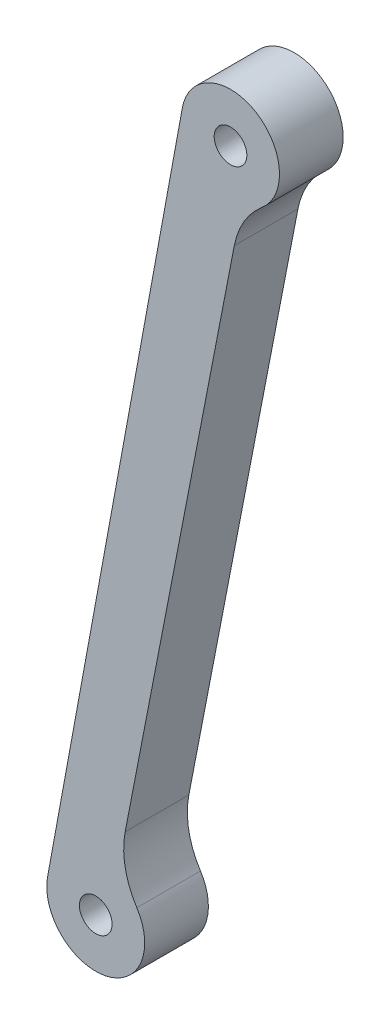
from build123d import *

# Parameters (mm, degrees)
SKETCH7_R           = 1
BOSS_EXTRUDE2_DEPTH = 3.9


with BuildPart() as part:
    # Sketch7 → Boss-Extrude2 (new body)
    with BuildSketch(Plane.XY):
        with BuildLine():
            Line((14.939494353, 43.671800322), (23.195274145, 88.592442488))
            ThreePointArc((23.195274145, 88.592442488), (27.655886689, 90.642426594), (28.073058509, 85.75106004))
            ThreePointArc((28.073058509, 85.75106004), (26.977195581, 84.457381822), (26.376654335, 82.871863263))
            Line((26.376654335, 82.871863263), (19.693168718, 48.435996906))
            ThreePointArc((19.693168718, 48.435996906), (19.693341996, 46.529807983), (20.406889033, 44.762208802))
            ThreePointArc((20.406889033, 44.762208802), (18.476836527, 40.187465572), (14.939494353, 43.671800322))
        make_face()
        with Locations((17.890076902, 43.129524909)):
            Circle(SKETCH7_R, mode=Mode.SUBTRACT)
        with Locations((26.145856694, 88.050167075)):
            Circle(SKETCH7_R, mode=Mode.SUBTRACT)
    extrude(amount=BOSS_EXTRUDE2_DEPTH)


solid = part.part
